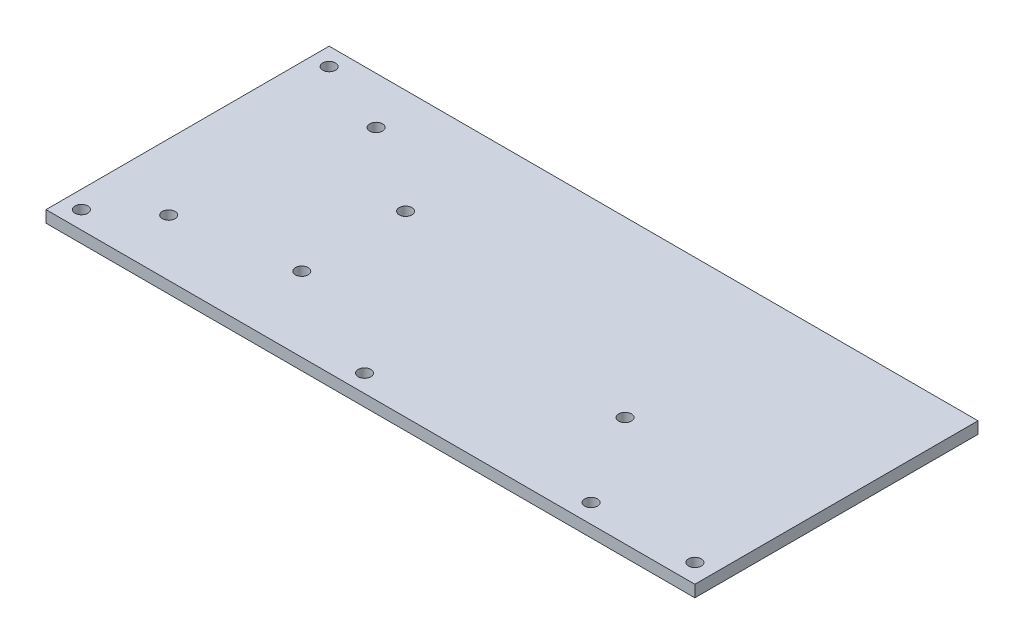
from build123d import *

# Parameters (mm, degrees)
BASE_SKETCH_W                              = 174.625
BASE_SKETCH_H                              = 76.2
BASE_PLATE_DEPTH                           = 3.175
F_4_40_GUIDE_RAIL_HOLES_REACH              = 97.316
F_4_40_HOLE_PATTERN_SKETCH_GUIDE_RAIL_R    = 1.7145
F_4_40_ARDUINO_HOLES_REACH                 = 97.316
F_4_40_HOLE_PATTERN_SKETCH_ARDUINO_HOLES_R = 1.7145
F_4_40_IMU_MOUNT_HOLES_REACH               = 97.316
F_4_40_HOLE_PATTERN_SKETCH_IMU_MOUNT_R     = 1.7145


with BuildPart() as part:
    # Base Sketch → Base Plate (new body)
    with BuildSketch(Plane(origin=(0, 0, 0), x_dir=(1, 0, 0), z_dir=(0, 1, 0))):
        Rectangle(BASE_SKETCH_W, BASE_SKETCH_H)
    extrude(amount=BASE_PLATE_DEPTH)

    # 4-40 Hole Pattern Sketch (Guide Rail) → 4-40 Guide Rail Holes (cut, up to next)
    with BuildSketch(Plane(origin=(0, 3.175, 0), x_dir=(1, 0, 0), z_dir=(0, 1, 0)), mode=Mode.PRIVATE) as f_4_40_guide_rail_holes_sk1:
        with Locations(Location((-82.55, 33.3375, 0), (0, 0, 270))):
            Circle(F_4_40_HOLE_PATTERN_SKETCH_GUIDE_RAIL_R)
    f_4_40_guide_rail_holes_tool1 = extrude(f_4_40_guide_rail_holes_sk1.sketch, amount=-F_4_40_GUIDE_RAIL_HOLES_REACH, mode=Mode.PRIVATE) & part.part
    # 4-40 Hole Pattern Sketch (Guide Rail) → 4-40 Guide Rail Holes (cut, up to next)
    with BuildSketch(Plane(origin=(0, 3.175, 0), x_dir=(1, 0, 0), z_dir=(0, 1, 0)), mode=Mode.PRIVATE) as f_4_40_guide_rail_holes_sk2:
        with Locations(Location((-82.55, -33.3375, 0), (0, 0, 270))):
            Circle(F_4_40_HOLE_PATTERN_SKETCH_GUIDE_RAIL_R)
    f_4_40_guide_rail_holes_tool2 = extrude(f_4_40_guide_rail_holes_sk2.sketch, amount=-F_4_40_GUIDE_RAIL_HOLES_REACH, mode=Mode.PRIVATE) & part.part
    # 4-40 Hole Pattern Sketch (Guide Rail) → 4-40 Guide Rail Holes (cut, up to next)
    with BuildSketch(Plane(origin=(0, 3.175, 0), x_dir=(1, 0, 0), z_dir=(0, 1, 0)), mode=Mode.PRIVATE) as f_4_40_guide_rail_holes_sk3:
        with Locations(Location((-6.35, -33.3375, 0), (0, 0, 270))):
            Circle(F_4_40_HOLE_PATTERN_SKETCH_GUIDE_RAIL_R)
    f_4_40_guide_rail_holes_tool3 = extrude(f_4_40_guide_rail_holes_sk3.sketch, amount=-F_4_40_GUIDE_RAIL_HOLES_REACH, mode=Mode.PRIVATE) & part.part
    add(f_4_40_guide_rail_holes_tool1.solids().sort_by_distance((-82.55, 3.175, -33.3375))[0], mode=Mode.SUBTRACT)
    add(f_4_40_guide_rail_holes_tool2.solids().sort_by_distance((-82.55, 3.175, 33.3375))[0], mode=Mode.SUBTRACT)
    add(f_4_40_guide_rail_holes_tool3.solids().sort_by_distance((-6.35, 3.175, 33.3375))[0], mode=Mode.SUBTRACT)

    # 4-40 Hole Pattern Sketch (Arduino Holes) → 4-40 Arduino Holes (cut, up to next)
    with BuildSketch(Plane(origin=(0, 3.175, 0), x_dir=(1, 0, 0), z_dir=(0, 1, 0)), mode=Mode.PRIVATE) as f_4_40_arduino_holes_sk1:
        with Locations(Location((-38.5445, -18.034, 0), (0, 0, 270))):
            Circle(F_4_40_HOLE_PATTERN_SKETCH_ARDUINO_HOLES_R)
    f_4_40_arduino_holes_tool1 = extrude(f_4_40_arduino_holes_sk1.sketch, amount=-F_4_40_ARDUINO_HOLES_REACH, mode=Mode.PRIVATE) & part.part
    # 4-40 Hole Pattern Sketch (Arduino Holes) → 4-40 Arduino Holes (cut, up to next)
    with BuildSketch(Plane(origin=(0, 3.175, 0), x_dir=(1, 0, 0), z_dir=(0, 1, 0)), mode=Mode.PRIVATE) as f_4_40_arduino_holes_sk2:
        with Locations(Location((-38.5445, 9.906, 0), (0, 0, 270))):
            Circle(F_4_40_HOLE_PATTERN_SKETCH_ARDUINO_HOLES_R)
    f_4_40_arduino_holes_tool2 = extrude(f_4_40_arduino_holes_sk2.sketch, amount=-F_4_40_ARDUINO_HOLES_REACH, mode=Mode.PRIVATE) & part.part
    # 4-40 Hole Pattern Sketch (Arduino Holes) → 4-40 Arduino Holes (cut, up to next)
    with BuildSketch(Plane(origin=(0, 3.175, 0), x_dir=(1, 0, 0), z_dir=(0, 1, 0)), mode=Mode.PRIVATE) as f_4_40_arduino_holes_sk3:
        with Locations(Location((-69.5325, -22.86, 0), (0, 0, 270))):
            Circle(F_4_40_HOLE_PATTERN_SKETCH_ARDUINO_HOLES_R)
    f_4_40_arduino_holes_tool3 = extrude(f_4_40_arduino_holes_sk3.sketch, amount=-F_4_40_ARDUINO_HOLES_REACH, mode=Mode.PRIVATE) & part.part
    # 4-40 Hole Pattern Sketch (Arduino Holes) → 4-40 Arduino Holes (cut, up to next)
    with BuildSketch(Plane(origin=(0, 3.175, 0), x_dir=(1, 0, 0), z_dir=(0, 1, 0)), mode=Mode.PRIVATE) as f_4_40_arduino_holes_sk4:
        with Locations(Location((-62.0395, 25.4762, 0), (0, 0, 270))):
            Circle(F_4_40_HOLE_PATTERN_SKETCH_ARDUINO_HOLES_R)
    f_4_40_arduino_holes_tool4 = extrude(f_4_40_arduino_holes_sk4.sketch, amount=-F_4_40_ARDUINO_HOLES_REACH, mode=Mode.PRIVATE) & part.part
    add(f_4_40_arduino_holes_tool1.solids().sort_by_distance((-38.5445, 3.175, 18.034))[0], mode=Mode.SUBTRACT)
    add(f_4_40_arduino_holes_tool2.solids().sort_by_distance((-38.5445, 3.175, -9.906))[0], mode=Mode.SUBTRACT)
    add(f_4_40_arduino_holes_tool3.solids().sort_by_distance((-69.5325, 3.175, 22.86))[0], mode=Mode.SUBTRACT)
    add(f_4_40_arduino_holes_tool4.solids().sort_by_distance((-62.0395, 3.175, -25.4762))[0], mode=Mode.SUBTRACT)

    # 4-40 Hole Pattern Sketch (IMU Mount) → 4-40 IMU Mount Holes (cut, up to next)
    with BuildSketch(Plane(origin=(0, 3.175, 0), x_dir=(1, 0, 0), z_dir=(0, 1, 0)), mode=Mode.PRIVATE) as f_4_40_imu_mount_holes_sk1:
        with Locations(Location((82.2325, -33.02, 0), (0, 0, 270))):
            Circle(F_4_40_HOLE_PATTERN_SKETCH_IMU_MOUNT_R)
    f_4_40_imu_mount_holes_tool1 = extrude(f_4_40_imu_mount_holes_sk1.sketch, amount=-F_4_40_IMU_MOUNT_HOLES_REACH, mode=Mode.PRIVATE) & part.part
    # 4-40 Hole Pattern Sketch (IMU Mount) → 4-40 IMU Mount Holes (cut, up to next)
    with BuildSketch(Plane(origin=(0, 3.175, 0), x_dir=(1, 0, 0), z_dir=(0, 1, 0)), mode=Mode.PRIVATE) as f_4_40_imu_mount_holes_sk2:
        with Locations(Location((54.2925, -33.02, 0), (0, 0, 270))):
            Circle(F_4_40_HOLE_PATTERN_SKETCH_IMU_MOUNT_R)
    f_4_40_imu_mount_holes_tool2 = extrude(f_4_40_imu_mount_holes_sk2.sketch, amount=-F_4_40_IMU_MOUNT_HOLES_REACH, mode=Mode.PRIVATE) & part.part
    # 4-40 Hole Pattern Sketch (IMU Mount) → 4-40 IMU Mount Holes (cut, up to next)
    with BuildSketch(Plane(origin=(0, 3.175, 0), x_dir=(1, 0, 0), z_dir=(0, 1, 0)), mode=Mode.PRIVATE) as f_4_40_imu_mount_holes_sk3:
        with Locations(Location((39.0525, -8.636, 0), (0, 0, 270))):
            Circle(F_4_40_HOLE_PATTERN_SKETCH_IMU_MOUNT_R)
    f_4_40_imu_mount_holes_tool3 = extrude(f_4_40_imu_mount_holes_sk3.sketch, amount=-F_4_40_IMU_MOUNT_HOLES_REACH, mode=Mode.PRIVATE) & part.part
    add(f_4_40_imu_mount_holes_tool1.solids().sort_by_distance((82.2325, 3.175, 33.02))[0], mode=Mode.SUBTRACT)
    add(f_4_40_imu_mount_holes_tool2.solids().sort_by_distance((54.2925, 3.175, 33.02))[0], mode=Mode.SUBTRACT)
    add(f_4_40_imu_mount_holes_tool3.solids().sort_by_distance((39.0525, 3.175, 8.636))[0], mode=Mode.SUBTRACT)


solid = part.part
